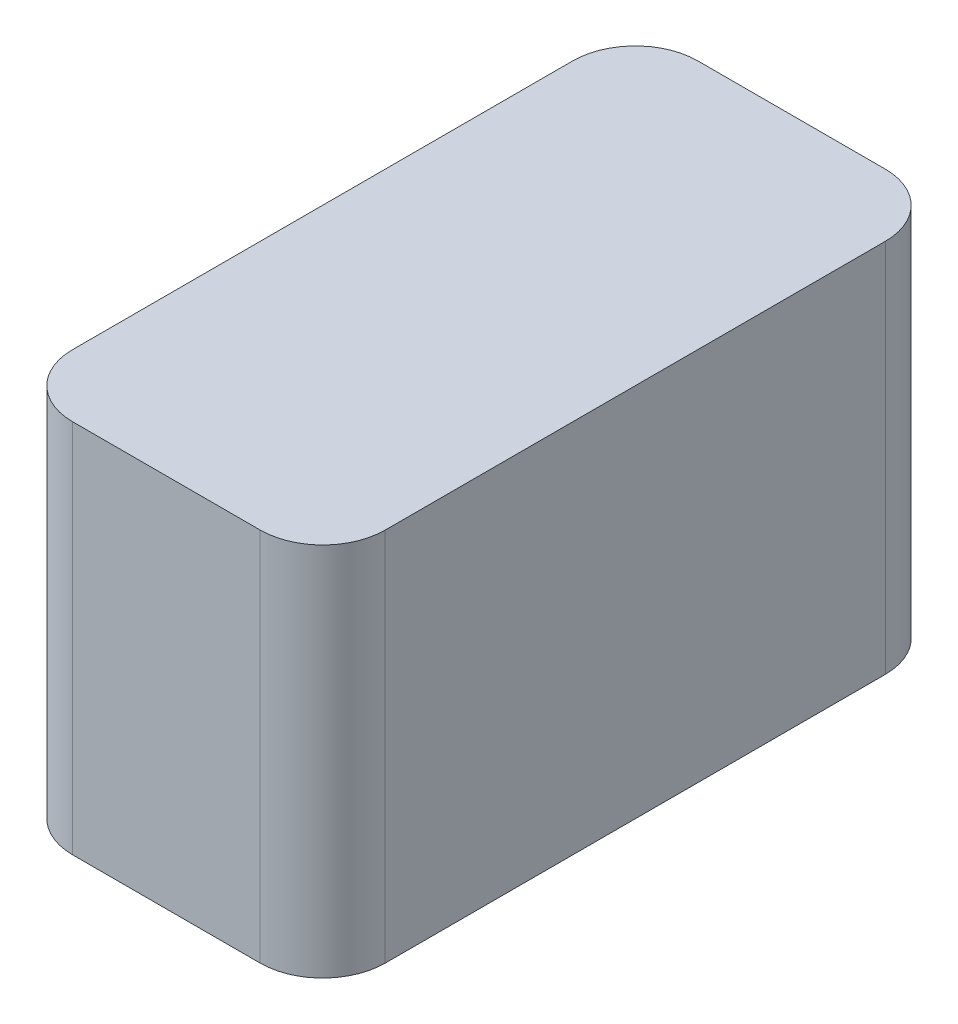
from build123d import *

# Parameters (mm, degrees)
BOSS_EXTRUDE1_DEPTH = 6


with BuildPart() as part:
    # Sketch1 → Boss-Extrude1 (new body)
    with BuildSketch(Plane(origin=(0, 0, 0), x_dir=(1, 0, 0), z_dir=(0, 1, 0))):
        with BuildLine():
            Line((-1.5, 5), (1.5, 5))
            ThreePointArc((1.5, 5), (2.207106781, 4.707106781), (2.5, 4))
            Line((2.5, 4), (2.5, -4))
            ThreePointArc((2.5, -4), (2.207106781, -4.707106781), (1.5, -5))
            Line((1.5, -5), (-1.5, -5))
            ThreePointArc((-1.5, -5), (-2.207106781, -4.707106781), (-2.5, -4))
            Line((-2.5, -4), (-2.5, 4))
            ThreePointArc((-2.5, 4), (-2.207106781, 4.707106781), (-1.5, 5))
        make_face()
    extrude(amount=BOSS_EXTRUDE1_DEPTH)


solid = part.part
